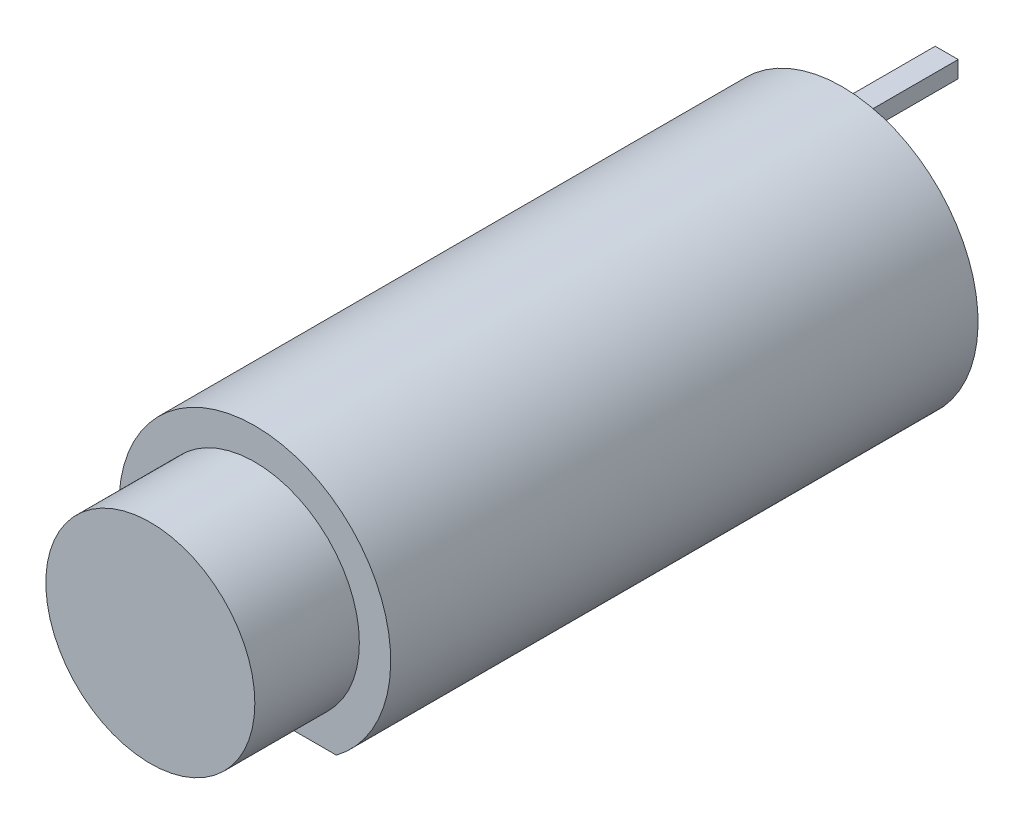
from build123d import *

# Parameters (mm, degrees)
EXTRUDE_1_DEPTH     = 33.1
CUT_EXTRUDE_START   = -5
SKETCH_2_R          = 5
CUT_EXTRUDE_1_DEPTH = 5
SKETCH_3_W          = 1.1
SKETCH_3_H          = 0.8
EXTRUDE_2_DEPTH     = 5


with BuildPart() as part:
    # 草图1 → 凸台-拉伸1 (new body)
    with BuildSketch(Plane.XY):
        with BuildLine():
            Line((-3.9, -5.2), (3.9, -5.2))
            ThreePointArc((3.9, -5.2), (0, 6.5), (-3.9, -5.2))
        make_face()
    extrude(amount=EXTRUDE_1_DEPTH)

    # 草图2 → 切除-拉伸1 (cut)
    with BuildSketch(Plane.XY.offset(33.1).offset(CUT_EXTRUDE_START)):
        with BuildLine():
            Line((-3.9, -5.2), (3.9, -5.2))
            ThreePointArc((3.9, -5.2), (0, 6.5), (-3.9, -5.2))
        make_face()
        Circle(SKETCH_2_R, mode=Mode.SUBTRACT)
    extrude(amount=CUT_EXTRUDE_1_DEPTH, mode=Mode.SUBTRACT)

    # 草图3 → 凸台-拉伸2 (add)
    with BuildSketch(Plane(origin=(0, -5.2, 0), x_dir=(1, 0, 0), z_dir=(0, 0, 1))):
        with Locations((0, 10.2)):
            Rectangle(SKETCH_3_W, SKETCH_3_H)
        with Locations((0, 0.2)):
            Rectangle(SKETCH_3_W, SKETCH_3_H)
    extrude(amount=-EXTRUDE_2_DEPTH)


solid = part.part
